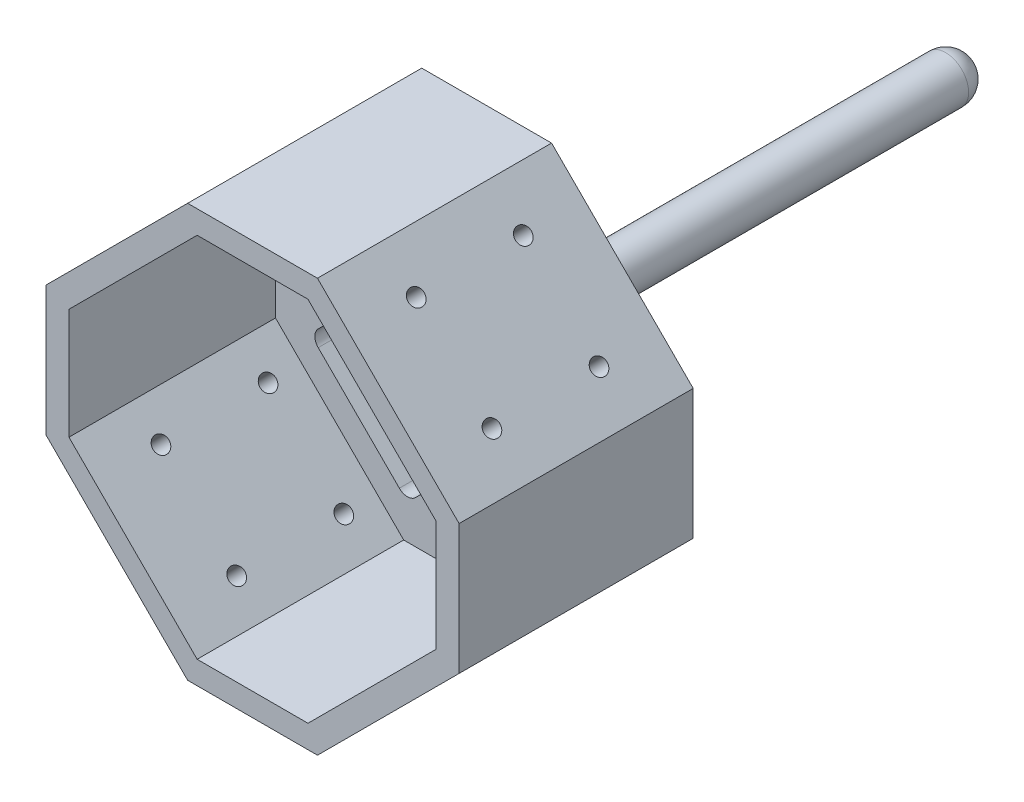
from build123d import *

# Parameters (mm, degrees)
BOSS_EXTRU_2_DEPTH      = 50
ESQUISSE5_R             = 1.75
ENL_V_MAT_EXTRU_2_DEPTH = 117.711988712
ESQUISSE6_R             = 1.75
ENL_V_MAT_EXTRU_3_DEPTH = 117.711988712
ENL_V_MAT_EXTRU_5_DEPTH = 44
ESQUISSE8_R             = 5
BOSS_EXTRU_3_DEPTH      = 100
ENL_V_MAT_EXTRU_6_DEPTH = 124.636564171
CONG_1_R                = 2.5
R_VOLUTION1_ANGLE       = 180
BOSS_EXTRU_4_DEPTH      = 1
CONG_2_R                = 10


with BuildPart() as part:
    # Esquisse4 → Boss.-Extru.2 (new body)
    with BuildSketch(Plane.XY):
        Polygon((-14.142135624, 45), (14.142135624, 45), (45, 14.142135624), (45, -14.142135624), (14.142135624, -45), (-14.142135624, -45), (-45, -14.142135624), (-45, 14.142135624), align=None)
    extrude(amount=BOSS_EXTRU_2_DEPTH)

    # Esquisse5 → Enlèv. mat.-Extru.2 (cut, through all)
    with BuildSketch(Plane(origin=(29.571067812, 29.571067812, 0), x_dir=(0, 0, -1), z_dir=(0.7071067811865474, 0.7071067811865477, 0))):
        with Locations(Location((-13.335, 11.665, 0), (0, 0, 90))):
            Circle(ESQUISSE5_R)
        with Locations(Location((-36.665, 11.665, 0), (0, 0, 90))):
            Circle(ESQUISSE5_R)
        with Locations(Location((-13.335, -11.665, 0), (0, 0, 90))):
            Circle(ESQUISSE5_R)
        with Locations(Location((-36.665, -11.665, 0), (0, 0, 90))):
            Circle(ESQUISSE5_R)
    extrude(amount=-ENL_V_MAT_EXTRU_2_DEPTH, mode=Mode.SUBTRACT)

    # Esquisse6 → Enlèv. mat.-Extru.3 (cut, through all)
    with BuildSketch(Plane(origin=(29.571067812, -29.571067812, 0), x_dir=(0, 0, -1), z_dir=(0.7071067811865476, -0.7071067811865476, 0))):
        with Locations(Location((-13.335, 11.665, 0), (0, 0, 90))):
            Circle(ESQUISSE6_R)
        with Locations((-36.665, 11.665)):
            Circle(ESQUISSE6_R)
        with Locations((-13.335, -11.665)):
            Circle(ESQUISSE6_R)
        with Locations((-36.665, -11.665)):
            Circle(ESQUISSE6_R)
    extrude(amount=-ENL_V_MAT_EXTRU_3_DEPTH, mode=Mode.SUBTRACT)

    # Esquisse7 → Enlèv. mat.-Extru.5 (cut)
    with BuildSketch(Plane.XY.offset(50)):
        Polygon((-40, 12.071067812), (-12.071067812, 40), (12.071067812, 40), (40, 12.071067812), (40, -12.071067812), (12.071067812, -40), (-12.071067812, -40), (-40, -12.071067812), align=None)
    extrude(amount=-ENL_V_MAT_EXTRU_5_DEPTH, mode=Mode.SUBTRACT)

    # Esquisse8 → Boss.-Extru.3 (add)
    with BuildSketch(Plane(origin=(0, 0, 0), x_dir=(-1, 0, 0), z_dir=(0, 0, -1))):
        Circle(ESQUISSE8_R)
    extrude(amount=BOSS_EXTRU_3_DEPTH)

    # Esquisse9 → Enlèv. mat.-Extru.6 (cut, through all)
    with BuildSketch(Plane.XY.offset(6)):
        Polygon((-13.017766953, 13.017766953), (-0.289844892, 25.745689014), (-9.128679656, 34.584523779), (-34.584523779, 9.128679656), (-25.745689014, 0.289844892), align=None)
        Polygon((25.745689014, -0.289844892), (34.584523779, -9.128679656), (9.128679656, -34.584523779), (0.289844892, -25.745689014), (13.017766953, -13.017766953), align=None)
        Polygon((-13.017766953, -13.017766953), (-23.624368671, -2.411165235), (-32.463203436, -11.25), (-11.25, -32.463203436), (-2.411165235, -23.624368671), align=None)
        Polygon((2.411165235, 23.624368671), (11.25, 32.463203436), (32.463203436, 11.25), (23.624368671, 2.411165235), (13.017766953, 13.017766953), align=None)
    extrude(amount=-ENL_V_MAT_EXTRU_6_DEPTH, mode=Mode.SUBTRACT)

    # Congé1
    cong_1_edges = [part.edges().sort_by_distance(p)[0] for p in [
        (2.411165235, 23.624368671, 3),
        (11.25, 32.463203436, 3),
        (32.463203436, 11.25, 3),
        (23.624368671, 2.411165235, 3),
        (-2.411165235, -23.624368671, 3),
        (-11.25, -32.463203436, 3),
        (-32.463203436, -11.25, 3),
        (-23.624368671, -2.411165235, 3),
        (25.745689014, -0.289844892, 3),
        (34.584523779, -9.128679656, 3),
        (9.128679656, -34.584523779, 3),
        (0.289844892, -25.745689014, 3),
        (-25.745689014, 0.289844892, 3),
        (-34.584523779, 9.128679656, 3),
        (-9.128679656, 34.584523779, 3),
        (-0.289844892, 25.745689014, 3),
    ]]
    fillet(cong_1_edges, radius=CONG_1_R)

    # Esquisse12 → Révolution1 (revolve)
    with BuildSketch(Plane(origin=(0, 0, -100), x_dir=(-1, 0, 0), z_dir=(0, 0, -1))):
        with BuildLine():
            Line((-5, 0), (5, 0))
            ThreePointArc((5, 0), (0, 5), (-5, 0))
        make_face()
    revolve(axis=Axis((5, 0, -100), (-1, 0, 0)), revolution_arc=R_VOLUTION1_ANGLE)

    # Esquisse13 → Boss.-Extru.4 (add)
    with BuildSketch(Plane.XY.offset(50)):
        Polygon((-45, 14.142135624), (-14.142135624, 45), (14.142135624, 45), (45, 14.142135624), (45, -14.142135624), (14.142135624, -45), (-14.142135624, -45), (-45, -14.142135624), align=None)
        Polygon((-40, 12.071067812), (-12.071067812, 40), (12.071067812, 40), (40, 12.071067812), (40, -12.071067812), (12.071067812, -40), (-12.071067812, -40), (-40, -12.071067812), align=None, mode=Mode.SUBTRACT)
    extrude(amount=BOSS_EXTRU_4_DEPTH)

    # Congé2
    cong_2_edges = [part.edges().sort_by_distance(p)[0] for p in [
        (5, 0, 0),
    ]]
    fillet(cong_2_edges, radius=CONG_2_R)


solid = part.part
